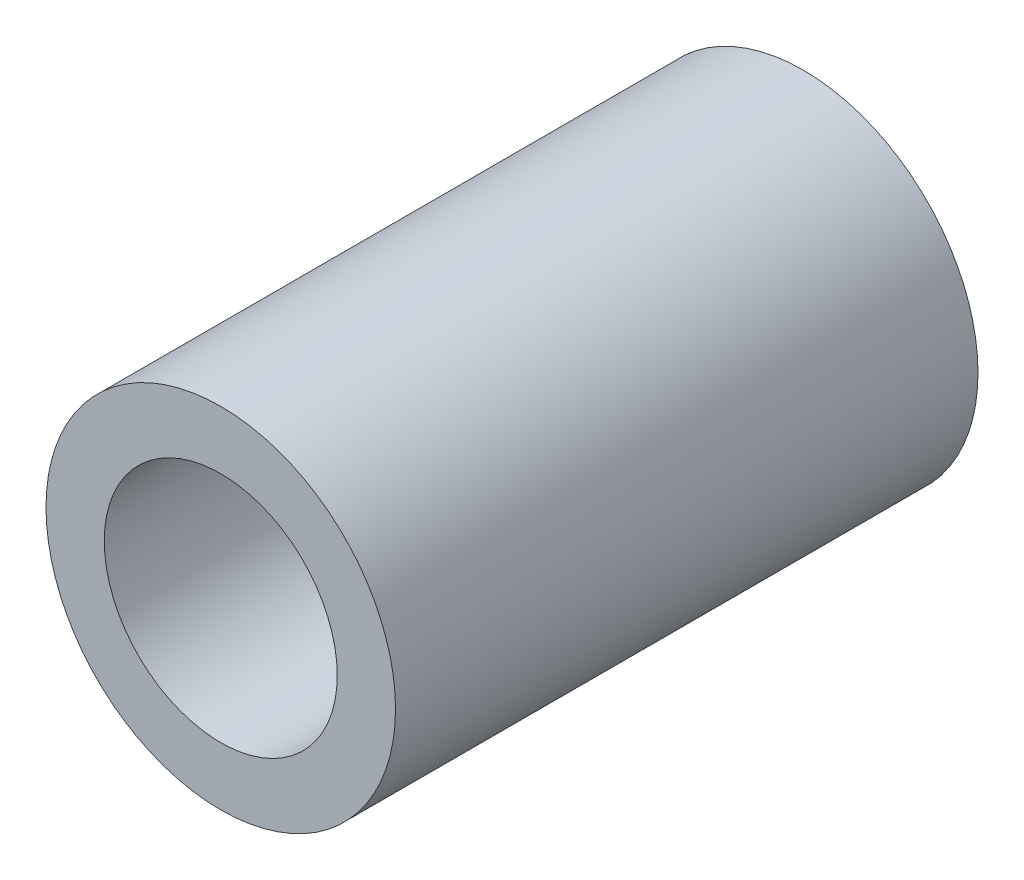
from build123d import *

# Parameters (mm, degrees)
ESBO_O1_R                = 3
ESBO_O1_R_2              = 2
RESSALTO_EXTRUS_O1_DEPTH = 10


with BuildPart() as part:
    # Esboço1 → Ressalto-extrusão1 (new body)
    with BuildSketch(Plane.XY):
        Circle(ESBO_O1_R)
        Circle(ESBO_O1_R_2, mode=Mode.SUBTRACT)
    extrude(amount=RESSALTO_EXTRUS_O1_DEPTH)


solid = part.part
